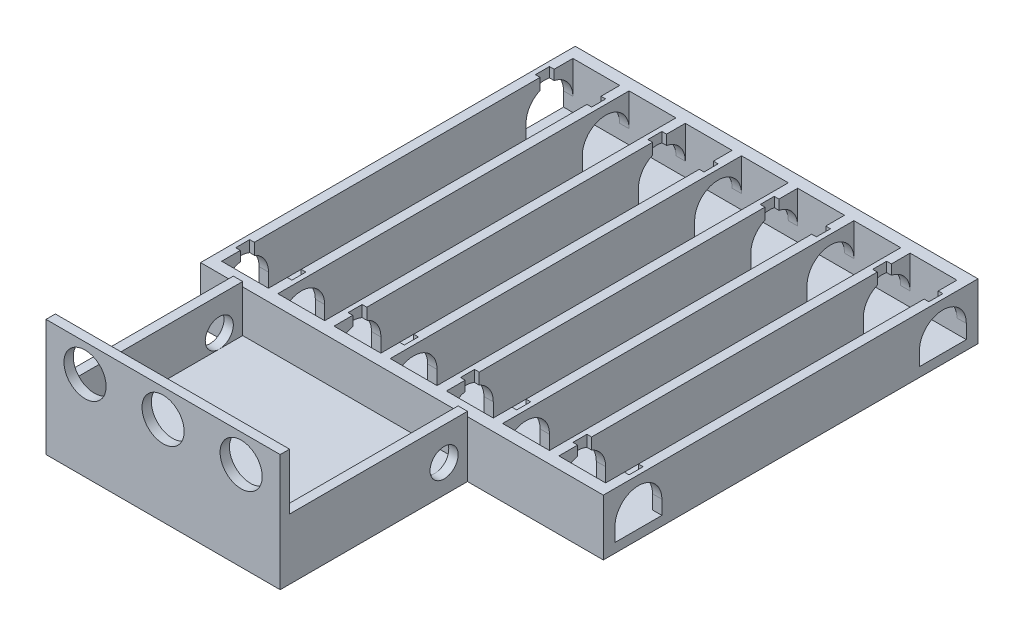
from build123d import *

# Parameters (mm, degrees)
SKETCH1_W               = 14
SKETCH1_H               = 80
BOSS_EXTRUDE1_DEPTH     = 2
SKETCH2_W               = 14
SKETCH2_H               = 80
SKETCH2_W_2             = 10
SKETCH2_H_2             = 75
BOSS_EXTRUDE2_DEPTH     = 10
SKETCH3_W               = 1
SKETCH3_H               = 3
CUT_EXTRUDE1_DEPTH      = 10
CUT_EXTRUDE2_DEPTH      = 14
SKETCH5_W               = 72
SKETCH5_H               = 80
BOSS_EXTRUDE3_DEPTH     = 2
SKETCH6_W               = 14
SKETCH6_H               = 80
SKETCH6_W_2             = 10
SKETCH6_H_2             = 75
BOSS_EXTRUDE4_DEPTH     = 10
MIRROR2_COPY_1_SKETCH_W = 1
MIRROR2_COPY_1_SKETCH_H = 3
MIRROR2_COPY_1_DEPTH    = 10
MIRROR5_COPY_1_DEPTH    = 14
SKETCH7_W               = 10
SKETCH7_H               = 2.5
BOSS_EXTRUDE5_DEPTH     = 10
SKETCH8_W               = 50
SKETCH8_H               = 40
BOSS_EXTRUDE6_DEPTH     = 3
BOSS_EXTRUDE7_DEPTH     = 10
SKETCH10_R              = 3
CUT_EXTRUDE3_DEPTH      = 50
SKETCH11_W              = 50
SKETCH11_H              = 2
BOSS_EXTRUDE8_DEPTH     = 12
SKETCH12_R              = 4.5
CUT_EXTRUDE4_DEPTH      = 2


with BuildPart() as part:
    # Sketch1 → Boss-Extrude1 (new body)
    with BuildSketch(Plane(origin=(0, 0, 0), x_dir=(1, 0, 0), z_dir=(0, 1, 0))):
        Rectangle(SKETCH1_W, SKETCH1_H)
    extrude(amount=BOSS_EXTRUDE1_DEPTH)

    # Sketch2 → Boss-Extrude2 (add)
    with BuildSketch(Plane(origin=(0, 2, 0), x_dir=(1, 0, 0), z_dir=(0, 1, 0))):
        Rectangle(SKETCH2_W, SKETCH2_H)
        Rectangle(SKETCH2_W_2, SKETCH2_H_2, mode=Mode.SUBTRACT)
    extrude(amount=BOSS_EXTRUDE2_DEPTH)

    # Sketch3 → Cut-Extrude1 (cut)
    with BuildSketch(Plane(origin=(0, 12, 0), x_dir=(1, 0, 0), z_dir=(0, 1, 0))):
        with Locations((-5.5, -32)):
            Rectangle(SKETCH3_W, SKETCH3_H)
        with Locations((5.5, -32)):
            Rectangle(SKETCH3_W, SKETCH3_H)
        with Locations((5.5, 32)):
            Rectangle(SKETCH3_W, SKETCH3_H)
        with Locations((-5.5, 32)):
            Rectangle(SKETCH3_W, SKETCH3_H)
    cut_extrude1 = extrude(amount=-CUT_EXTRUDE1_DEPTH, mode=Mode.SUBTRACT)

    # Sketch4 → Cut-Extrude2 (cut)
    with BuildSketch(Plane(origin=(7, 0, 0), x_dir=(0, 0, -1), z_dir=(1, 0, 0))):
        with BuildLine():
            ThreePointArc((-37.5, 5), (-32.5, 10), (-27.5, 5))
            Line((-27.5, 5), (-27.5, 2))
            Line((-27.5, 2), (-32.5, 2))
            Line((-32.5, 2), (-37.5, 2))
            Line((-37.5, 2), (-37.5, 5))
        make_face()
        with BuildLine():
            ThreePointArc((27.5, 5), (32.5, 10), (37.5, 5))
            Line((37.5, 5), (37.5, 2))
            Line((37.5, 2), (32.5, 2))
            Line((32.5, 2), (27.5, 2))
            Line((27.5, 2), (27.5, 5))
        make_face()
    cut_extrude2 = extrude(amount=-CUT_EXTRUDE2_DEPTH, mode=Mode.SUBTRACT)

    # Sketch5 → Boss-Extrude3 (add)
    with BuildSketch(Plane(origin=(0, 0, 0), x_dir=(1, 0, 0), z_dir=(0, 1, 0))):
        with Locations((43, 0)):
            Rectangle(SKETCH5_W, SKETCH5_H)
    extrude(amount=BOSS_EXTRUDE3_DEPTH)

    # Sketch6 → Boss-Extrude4 (add)
    # profile 1 of 3: a face of its own
    with BuildSketch(Plane(origin=(0, 2, 0), x_dir=(1, 0, 0), z_dir=(0, 1, 0))):
        with Locations((24, 0)):
            Rectangle(SKETCH6_W, SKETCH6_H)
        with Locations((24, 0)):
            Rectangle(SKETCH6_W_2, SKETCH6_H_2, mode=Mode.SUBTRACT)
    # profile 2 of 3: a face of its own
    with BuildSketch(Plane(origin=(0, 2, 0), x_dir=(1, 0, 0), z_dir=(0, 1, 0))):
        with Locations((48, 0)):
            Rectangle(SKETCH6_W, SKETCH6_H)
        with Locations((48, 0)):
            Rectangle(SKETCH6_W_2, SKETCH6_H_2, mode=Mode.SUBTRACT)
    # profile 3 of 3: a face of its own
    with BuildSketch(Plane(origin=(0, 2, 0), x_dir=(1, 0, 0), z_dir=(0, 1, 0))):
        with Locations((72, 0)):
            Rectangle(SKETCH6_W, SKETCH6_H)
        with Locations((72, 0)):
            Rectangle(SKETCH6_W_2, SKETCH6_H_2, mode=Mode.SUBTRACT)
    extrude(amount=BOSS_EXTRUDE4_DEPTH)

    # Mirror1: Cut-Extrude1 across plane
    add(cut_extrude1.mirror(Plane.ZY.offset(-12)), mode=Mode.SUBTRACT)

    # Mirror2: Cut-Extrude1 across plane
    add(cut_extrude1.mirror(Plane.ZY.offset(-36)), mode=Mode.SUBTRACT)

    # Mirror2 copy 1 sketch → Mirror2 copy 1 (cut)
    with BuildSketch(Plane(origin=(48, 12, 0), x_dir=(1, 0, 0), z_dir=(0, 1, 0))):
        with Locations((-5.5, -32)):
            Rectangle(MIRROR2_COPY_1_SKETCH_W, MIRROR2_COPY_1_SKETCH_H)
        with Locations((5.5, -32)):
            Rectangle(MIRROR2_COPY_1_SKETCH_W, MIRROR2_COPY_1_SKETCH_H)
        with Locations((5.5, 32)):
            Rectangle(MIRROR2_COPY_1_SKETCH_W, MIRROR2_COPY_1_SKETCH_H)
        with Locations((-5.5, 32)):
            Rectangle(MIRROR2_COPY_1_SKETCH_W, MIRROR2_COPY_1_SKETCH_H)
    extrude(amount=-MIRROR2_COPY_1_DEPTH, mode=Mode.SUBTRACT)

    # Mirror4: Cut-Extrude2 across plane
    add(cut_extrude2.mirror(Plane.ZY.offset(-12)), mode=Mode.SUBTRACT)

    # Mirror5: Cut-Extrude2 across plane
    add(cut_extrude2.mirror(Plane.ZY.offset(-36)), mode=Mode.SUBTRACT)

    # Mirror5 copy 1 sketch → Mirror5 copy 1 (cut)
    with BuildSketch(Plane(origin=(55, 0, 0), x_dir=(0, 0, -1), z_dir=(1, 0, 0))):
        with BuildLine():
            ThreePointArc((-37.5, 5), (-32.5, 10), (-27.5, 5))
            Line((-27.5, 5), (-27.5, 2))
            Line((-27.5, 2), (-32.5, 2))
            Line((-32.5, 2), (-37.5, 2))
            Line((-37.5, 2), (-37.5, 5))
        make_face()
        with BuildLine():
            ThreePointArc((27.5, 5), (32.5, 10), (37.5, 5))
            Line((37.5, 5), (37.5, 2))
            Line((37.5, 2), (32.5, 2))
            Line((32.5, 2), (27.5, 2))
            Line((27.5, 2), (27.5, 5))
        make_face()
    extrude(amount=-MIRROR5_COPY_1_DEPTH, mode=Mode.SUBTRACT)

    # Sketch7 → Boss-Extrude5 (add)
    with BuildSketch(Plane(origin=(0, 2, 0), x_dir=(1, 0, 0), z_dir=(0, 1, 0))):
        with Locations((12, 38.75)):
            Rectangle(SKETCH7_W, SKETCH7_H)
        with Locations((36, 38.75)):
            Rectangle(SKETCH7_W, SKETCH7_H)
        with Locations((60, 38.75)):
            Rectangle(SKETCH7_W, SKETCH7_H)
        with Locations((60, -38.75)):
            Rectangle(SKETCH7_W, SKETCH7_H)
        with Locations((36, -38.75)):
            Rectangle(SKETCH7_W, SKETCH7_H)
        with Locations((12, -38.75)):
            Rectangle(SKETCH7_W, SKETCH7_H)
    extrude(amount=BOSS_EXTRUDE5_DEPTH)

    # Sketch8 → Boss-Extrude6 (add)
    with BuildSketch(Plane(origin=(0, 0, 0), x_dir=(1, 0, 0), z_dir=(0, 1, 0))):
        with Locations((25, -60)):
            Rectangle(SKETCH8_W, SKETCH8_H)
    extrude(amount=BOSS_EXTRUDE6_DEPTH)

    # Sketch9 → Boss-Extrude7 (add)
    with BuildSketch(Plane(origin=(0, 3, 0), x_dir=(1, 0, 0), z_dir=(0, 1, 0))):
        Polygon((0, -40), (0, -80), (50, -80), (50, -40), (48, -40), (48, -78), (2, -78), (2, -40), align=None)
    extrude(amount=BOSS_EXTRUDE7_DEPTH)

    # Sketch10 → Cut-Extrude3 (cut)
    with BuildSketch(Plane.ZY):
        with Locations((45, 6)):
            Circle(SKETCH10_R)
    extrude(amount=-CUT_EXTRUDE3_DEPTH, mode=Mode.SUBTRACT)

    # Sketch11 → Boss-Extrude8 (add)
    with BuildSketch(Plane(origin=(0, 13, 0), x_dir=(1, 0, 0), z_dir=(0, 1, 0))):
        with Locations((25, -79)):
            Rectangle(SKETCH11_W, SKETCH11_H)
    extrude(amount=BOSS_EXTRUDE8_DEPTH)

    # Sketch12 → Cut-Extrude4 (cut)
    with BuildSketch(Plane.XY.offset(80)):
        with Locations((8.333333333, 19)):
            Circle(SKETCH12_R)
        with Locations((25, 19)):
            Circle(SKETCH12_R)
        with Locations((41.666666667, 19)):
            Circle(SKETCH12_R)
    extrude(amount=-CUT_EXTRUDE4_DEPTH, mode=Mode.SUBTRACT)


solid = part.part
